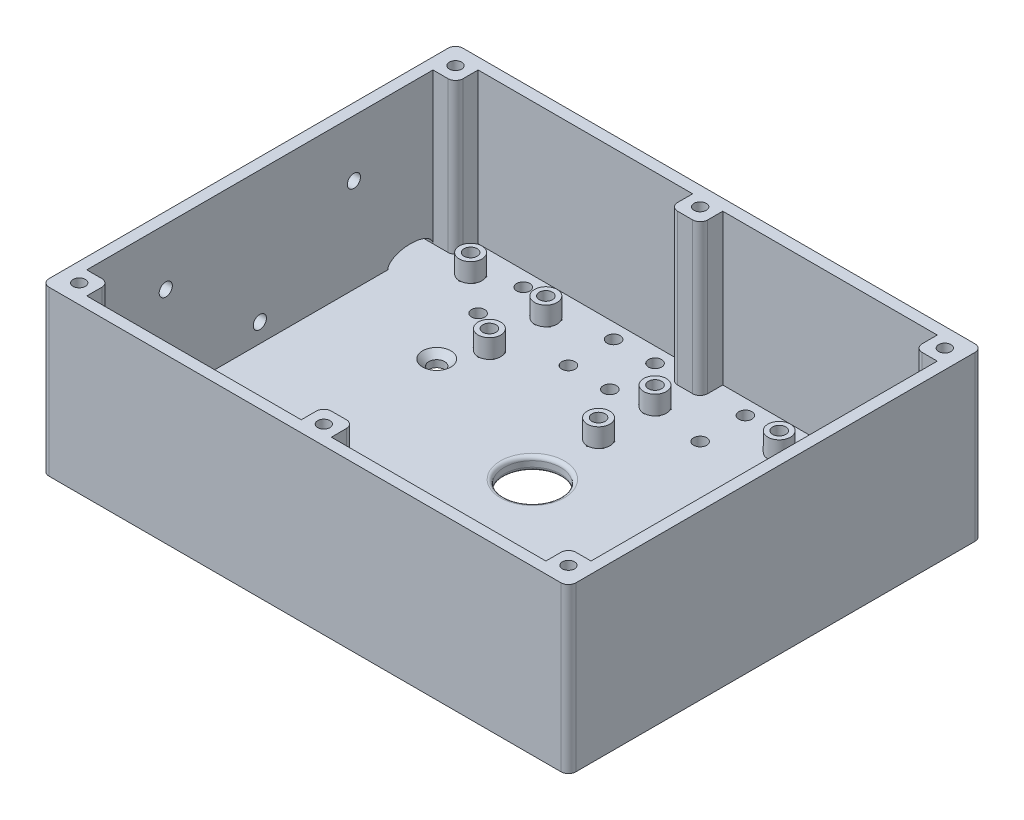
from build123d import *

# Parameters (mm, degrees)
SKETCH1_W                             = 140
SKETCH1_H                             = 110
BOTTOM_DEPTH                          = 3.5
SKETCH3_W                             = 140
SKETCH3_H                             = 110
WALL_DEPTH                            = 40
SKETCH4_R                             = 1.625
TOP_PLATE_SCREW_HOLES_DEPTH           = 30
TOP_PLATE_SCREW_HOLES_DRAFT           = -1
TOP_PLATE_SCREW_HOLES_PROFILE_2_DEPTH = 30
TOP_PLATE_SCREW_HOLES_PROFILE_2_DRAFT = -1
TOP_PLATE_SCREW_HOLES_PROFILE_3_DEPTH = 30
TOP_PLATE_SCREW_HOLES_PROFILE_3_DRAFT = -1
TOP_PLATE_SCREW_HOLES_PROFILE_4_DEPTH = 30
TOP_PLATE_SCREW_HOLES_PROFILE_4_DRAFT = -1
TOP_PLATE_SCREW_HOLES_PROFILE_5_DEPTH = 30
TOP_PLATE_SCREW_HOLES_PROFILE_5_DRAFT = -1
TOP_PLATE_SCREW_HOLES_PROFILE_6_DEPTH = 30
TOP_PLATE_SCREW_HOLES_PROFILE_6_DRAFT = -1
FILLET14_R                            = 2
FILLET13_R                            = 2
FILLET12_R                            = 2
FILLET11_R                            = 2
FILLET1_R                             = 2
FILLET2_R                             = 2
FILLET3_R                             = 2
FILLET4_R                             = 2
FILLET5_R                             = 2
FILLET6_R                             = 2
FILLET7_R                             = 2
FILLET8_R                             = 2
M4_MOUNT_R                            = 2.1
M4_MOUNT_CUT_DEPTH                    = 98.59610648
SKETCH7_R                             = 7.5
USB_CABEL_CUT_DEPTH                   = 100.082036717
FILLET9_R                             = 1
FILLET10_R                            = 1
SKETCH8_R                             = 1.75
UV_LAMP_M3_CUT_DEPTH                  = 10
M3_CONNECTION_R                       = 1.75
M3_CONNECTION_CUT_DEPTH               = 10
CABLE_PASS_CUT_DEPTH                  = 10
SKETCH9_R                             = 3
CURCUIT_BOARD_MOUNT_POSTS_EXT_DEPTH   = 5
SKETCH10_R                            = 1.75
M3_SCREW_CURCUIT_MOUNT_CUT_DEPTH      = 96.655632458
M3_HEAD_CIRCUIT_MOUNT_CUT_DEPTH       = 3.5


with BuildPart() as part:
    # Sketch1 → Bottom (new body)
    with BuildSketch(Plane(origin=(0, 0, 0), x_dir=(1, 0, 0), z_dir=(0, 1, 0))):
        Rectangle(SKETCH1_W, SKETCH1_H)
    extrude(amount=BOTTOM_DEPTH)

    # Sketch3 → Wall (add)
    with BuildSketch(Plane(origin=(0, 3.5, 0), x_dir=(1, 0, 0), z_dir=(0, 1, 0))):
        Rectangle(SKETCH3_W, SKETCH3_H)
        Polygon((-61, 52), (-4, 52), (-4, 46), (4, 46), (4, 52), (61, 52), (61, 46), (67, 46), (67, -46), (61, -46), (61, -52), (4, -52), (4, -46), (-4, -46), (-4, -52), (-61, -52), (-61, -46), (-67, -46), (-67, 46), (-61, 46), align=None, mode=Mode.SUBTRACT)
    extrude(amount=WALL_DEPTH)


with BuildPart() as top_plate_screw_holes_tool:
    # Sketch4 → Top Plate Screw Holes (with draft: the straight prism first)
    with BuildSketch(Plane(origin=(0, 43.5, 0), x_dir=(1, 0, 0), z_dir=(0, 1, 0))):
        with Locations((-65, 50)):
            Circle(SKETCH4_R)
    extrude(amount=-TOP_PLATE_SCREW_HOLES_DEPTH)
    # Top Plate Screw Holes: the draft: its side faces are tilted about the plane it starts from
    top_plate_screw_holes_sides = [top_plate_screw_holes_tool.faces().sort_by_distance(p)[0] for p in [
        (-66.625, 28.5, -50),
    ]]
    draft(top_plate_screw_holes_sides, Plane(origin=(0, 43.5, 0), x_dir=(1, 0, 0), z_dir=(0, 1, 0)), TOP_PLATE_SCREW_HOLES_DRAFT)


with BuildPart() as part_1:
    add(part.part)

    # Top Plate Screw Holes: cut by top_plate_screw_holes_tool
    add(top_plate_screw_holes_tool.part, mode=Mode.SUBTRACT)


with BuildPart() as top_plate_screw_holes_profile_2_tool:
    # Sketch4 → Top Plate Screw Holes profile 2 (with draft: the straight prism first)
    with BuildSketch(Plane(origin=(0, 43.5, 0), x_dir=(1, 0, 0), z_dir=(0, 1, 0))):
        with Locations((65, 50)):
            Circle(SKETCH4_R)
    extrude(amount=-TOP_PLATE_SCREW_HOLES_PROFILE_2_DEPTH)
    # Top Plate Screw Holes profile 2: the draft: its side faces are tilted about the plane it starts from
    top_plate_screw_holes_profile_2_sides = [top_plate_screw_holes_profile_2_tool.faces().sort_by_distance(p)[0] for p in [
        (63.375, 28.5, -50),
    ]]
    draft(top_plate_screw_holes_profile_2_sides, Plane(origin=(0, 43.5, 0), x_dir=(1, 0, 0), z_dir=(0, 1, 0)), TOP_PLATE_SCREW_HOLES_PROFILE_2_DRAFT)


with BuildPart() as part_2:
    add(part_1.part)

    # Top Plate Screw Holes profile 2: cut by top_plate_screw_holes_profile_2_tool
    add(top_plate_screw_holes_profile_2_tool.part, mode=Mode.SUBTRACT)


with BuildPart() as top_plate_screw_holes_profile_3_tool:
    # Sketch4 → Top Plate Screw Holes profile 3 (with draft: the straight prism first)
    with BuildSketch(Plane(origin=(0, 43.5, 0), x_dir=(1, 0, 0), z_dir=(0, 1, 0))):
        with Locations((65, -50)):
            Circle(SKETCH4_R)
    extrude(amount=-TOP_PLATE_SCREW_HOLES_PROFILE_3_DEPTH)
    # Top Plate Screw Holes profile 3: the draft: its side faces are tilted about the plane it starts from
    top_plate_screw_holes_profile_3_sides = [top_plate_screw_holes_profile_3_tool.faces().sort_by_distance(p)[0] for p in [
        (63.375, 28.5, 50),
    ]]
    draft(top_plate_screw_holes_profile_3_sides, Plane(origin=(0, 43.5, 0), x_dir=(1, 0, 0), z_dir=(0, 1, 0)), TOP_PLATE_SCREW_HOLES_PROFILE_3_DRAFT)


with BuildPart() as part_3:
    add(part_2.part)

    # Top Plate Screw Holes profile 3: cut by top_plate_screw_holes_profile_3_tool
    add(top_plate_screw_holes_profile_3_tool.part, mode=Mode.SUBTRACT)


with BuildPart() as top_plate_screw_holes_profile_4_tool:
    # Sketch4 → Top Plate Screw Holes profile 4 (with draft: the straight prism first)
    with BuildSketch(Plane(origin=(0, 43.5, 0), x_dir=(1, 0, 0), z_dir=(0, 1, 0))):
        with Locations((-65, -50)):
            Circle(SKETCH4_R)
    extrude(amount=-TOP_PLATE_SCREW_HOLES_PROFILE_4_DEPTH)
    # Top Plate Screw Holes profile 4: the draft: its side faces are tilted about the plane it starts from
    top_plate_screw_holes_profile_4_sides = [top_plate_screw_holes_profile_4_tool.faces().sort_by_distance(p)[0] for p in [
        (-66.625, 28.5, 50),
    ]]
    draft(top_plate_screw_holes_profile_4_sides, Plane(origin=(0, 43.5, 0), x_dir=(1, 0, 0), z_dir=(0, 1, 0)), TOP_PLATE_SCREW_HOLES_PROFILE_4_DRAFT)


with BuildPart() as part_4:
    add(part_3.part)

    # Top Plate Screw Holes profile 4: cut by top_plate_screw_holes_profile_4_tool
    add(top_plate_screw_holes_profile_4_tool.part, mode=Mode.SUBTRACT)


with BuildPart() as top_plate_screw_holes_profile_5_tool:
    # Sketch4 → Top Plate Screw Holes profile 5 (with draft: the straight prism first)
    with BuildSketch(Plane(origin=(0, 43.5, 0), x_dir=(1, 0, 0), z_dir=(0, 1, 0))):
        with Locations((0, 50)):
            Circle(SKETCH4_R)
    extrude(amount=-TOP_PLATE_SCREW_HOLES_PROFILE_5_DEPTH)
    # Top Plate Screw Holes profile 5: the draft: its side faces are tilted about the plane it starts from
    top_plate_screw_holes_profile_5_sides = [top_plate_screw_holes_profile_5_tool.faces().sort_by_distance(p)[0] for p in [
        (-1.625, 28.5, -50),
    ]]
    draft(top_plate_screw_holes_profile_5_sides, Plane(origin=(0, 43.5, 0), x_dir=(1, 0, 0), z_dir=(0, 1, 0)), TOP_PLATE_SCREW_HOLES_PROFILE_5_DRAFT)


with BuildPart() as part_5:
    add(part_4.part)

    # Top Plate Screw Holes profile 5: cut by top_plate_screw_holes_profile_5_tool
    add(top_plate_screw_holes_profile_5_tool.part, mode=Mode.SUBTRACT)


with BuildPart() as top_plate_screw_holes_profile_6_tool:
    # Sketch4 → Top Plate Screw Holes profile 6 (with draft: the straight prism first)
    with BuildSketch(Plane(origin=(0, 43.5, 0), x_dir=(1, 0, 0), z_dir=(0, 1, 0))):
        with Locations((0, -50)):
            Circle(SKETCH4_R)
    extrude(amount=-TOP_PLATE_SCREW_HOLES_PROFILE_6_DEPTH)
    # Top Plate Screw Holes profile 6: the draft: its side faces are tilted about the plane it starts from
    top_plate_screw_holes_profile_6_sides = [top_plate_screw_holes_profile_6_tool.faces().sort_by_distance(p)[0] for p in [
        (-1.625, 28.5, 50),
    ]]
    draft(top_plate_screw_holes_profile_6_sides, Plane(origin=(0, 43.5, 0), x_dir=(1, 0, 0), z_dir=(0, 1, 0)), TOP_PLATE_SCREW_HOLES_PROFILE_6_DRAFT)


with BuildPart() as part_6:
    add(part_5.part)

    # Top Plate Screw Holes profile 6: cut by top_plate_screw_holes_profile_6_tool
    add(top_plate_screw_holes_profile_6_tool.part, mode=Mode.SUBTRACT)

    # Fillet14
    fillet14_edges = [part_6.edges().sort_by_distance(p)[0] for p in [
        (-4, 23.5, 46),
    ]]
    fillet(fillet14_edges, radius=FILLET14_R)

    # Fillet13
    fillet13_edges = [part_6.edges().sort_by_distance(p)[0] for p in [
        (4, 23.5, 46),
    ]]
    fillet(fillet13_edges, radius=FILLET13_R)

    # Fillet12
    fillet12_edges = [part_6.edges().sort_by_distance(p)[0] for p in [
        (-4, 23.5, -46),
    ]]
    fillet(fillet12_edges, radius=FILLET12_R)

    # Fillet11
    fillet11_edges = [part_6.edges().sort_by_distance(p)[0] for p in [
        (4, 23.5, -46),
    ]]
    fillet(fillet11_edges, radius=FILLET11_R)

    # Fillet1
    fillet1_edges = [part_6.edges().sort_by_distance(p)[0] for p in [
        (-61, 23.5, 46),
    ]]
    fillet(fillet1_edges, radius=FILLET1_R)

    # Fillet2
    fillet2_edges = [part_6.edges().sort_by_distance(p)[0] for p in [
        (61, 23.5, 46),
    ]]
    fillet(fillet2_edges, radius=FILLET2_R)

    # Fillet3
    fillet3_edges = [part_6.edges().sort_by_distance(p)[0] for p in [
        (61, 23.5, -46),
    ]]
    fillet(fillet3_edges, radius=FILLET3_R)

    # Fillet4
    fillet4_edges = [part_6.edges().sort_by_distance(p)[0] for p in [
        (-61, 23.5, -46),
    ]]
    fillet(fillet4_edges, radius=FILLET4_R)

    # Fillet5
    fillet5_edges = [part_6.edges().sort_by_distance(p)[0] for p in [
        (-70, 21.75, -55),
    ]]
    fillet(fillet5_edges, radius=FILLET5_R)

    # Fillet6
    fillet6_edges = [part_6.edges().sort_by_distance(p)[0] for p in [
        (70, 21.75, -55),
    ]]
    fillet(fillet6_edges, radius=FILLET6_R)

    # Fillet7
    fillet7_edges = [part_6.edges().sort_by_distance(p)[0] for p in [
        (70, 21.75, 55),
    ]]
    fillet(fillet7_edges, radius=FILLET7_R)

    # Fillet8
    fillet8_edges = [part_6.edges().sort_by_distance(p)[0] for p in [
        (-70, 21.75, 55),
    ]]
    fillet(fillet8_edges, radius=FILLET8_R)

    # M4 Mount → M4 Mount Cut (cut, through all)
    with BuildSketch(Plane.XZ.offset(-3.5)):
        with Locations(Location((40, -20, 0), (0, 0, 270))):
            Circle(M4_MOUNT_R)
        with Locations(Location((40, 20, 0), (0, 0, 270))):
            Circle(M4_MOUNT_R)
        with Locations(Location((-40, 20, 0), (0, 0, 90))):
            Circle(M4_MOUNT_R)
        with Locations(Location((-40, -20, 0), (0, 0, 90))):
            Circle(M4_MOUNT_R)
    extrude(amount=M4_MOUNT_CUT_DEPTH, mode=Mode.SUBTRACT)

    # Cut-Extrude3 cone 1 section (through the dimple's axis) → Cut-Extrude3 (revolve, cut)
    with BuildSketch(Plane(origin=(40, 3.5, 20), x_dir=(0, 0, 1), z_dir=(1, 0, 0))):
        Polygon((0, 0), (3.75, 0), (0, 3.75), align=None)
    revolve(axis=Axis((40, 3.5, 20), (0, -1, 0)), mode=Mode.SUBTRACT)

    # Cut-Extrude3 cone 2 section (through the dimple's axis) → Cut-Extrude3 cone 2 (revolve, cut)
    with BuildSketch(Plane(origin=(40, 3.5, -20), x_dir=(0, 0, 1), z_dir=(1, 0, 0))):
        Polygon((0, 0), (3.75, 0), (0, 3.75), align=None)
    revolve(axis=Axis((40, 3.5, -20), (0, -1, 0)), mode=Mode.SUBTRACT)

    # Cut-Extrude3 cone 3 section (through the dimple's axis) → Cut-Extrude3 cone 3 (revolve, cut)
    with BuildSketch(Plane(origin=(-40, 3.5, -20), x_dir=(0, 0, 1), z_dir=(1, 0, 0))):
        Polygon((0, 0), (3.75, 0), (0, 3.75), align=None)
    revolve(axis=Axis((-40, 3.5, -20), (0, -1, 0)), mode=Mode.SUBTRACT)

    # Cut-Extrude3 cone 4 section (through the dimple's axis) → Cut-Extrude3 cone 4 (revolve, cut)
    with BuildSketch(Plane(origin=(-40, 3.5, 20), x_dir=(0, 0, 1), z_dir=(1, 0, 0))):
        Polygon((0, 0), (3.75, 0), (0, 3.75), align=None)
    revolve(axis=Axis((-40, 3.5, 20), (0, -1, 0)), mode=Mode.SUBTRACT)

    # Sketch7 → USB Cabel Cut (cut, through all)
    with BuildSketch(Plane.XZ):
        with Locations(Location((0.418373374, -5, 0), (0, 0, 270))):
            Circle(SKETCH7_R)
    extrude(amount=-USB_CABEL_CUT_DEPTH, mode=Mode.SUBTRACT)

    # Fillet9
    fillet9_edges = [part_6.edges().sort_by_distance(p)[0] for p in [
        (0.418373374, 0, 2.5),
    ]]
    fillet(fillet9_edges, radius=FILLET9_R)

    # Fillet10
    fillet10_edges = [part_6.edges().sort_by_distance(p)[0] for p in [
        (0.418373374, 3.5, 2.5),
    ]]
    fillet(fillet10_edges, radius=FILLET10_R)

    # Sketch8 → UV LAMP M3 CUT (cut)
    with BuildSketch(Plane(origin=(0, 3.5, 0), x_dir=(1, 0, 0), z_dir=(0, 1, 0))):
        with Locations(Location((-10, 48, 0), (0, 0, 270))):
            Circle(SKETCH8_R)
        with Locations(Location((-10, 36, 0), (0, 0, 270))):
            Circle(SKETCH8_R)
        with Locations(Location((14, 48, 0), (0, 0, 270))):
            Circle(SKETCH8_R)
        with Locations(Location((14, 36, 0), (0, 0, 270))):
            Circle(SKETCH8_R)
        with Locations(Location((-45, 48, 0), (0, 0, 270))):
            Circle(SKETCH8_R)
        with Locations(Location((-45, 36, 0), (0, 0, 270))):
            Circle(SKETCH8_R)
        with Locations(Location((-21, 48, 0), (0, 0, 270))):
            Circle(SKETCH8_R)
        with Locations(Location((-21, 36, 0), (0, 0, 270))):
            Circle(SKETCH8_R)
    extrude(amount=-UV_LAMP_M3_CUT_DEPTH, mode=Mode.SUBTRACT)

    # M3 Connection → M3 Connection CUT (cut)
    with BuildSketch(Plane(origin=(-67, 0, 0), x_dir=(0, 0, -1), z_dir=(1, 0, 0))):
        with Locations((25, 28.5)):
            Circle(M3_CONNECTION_R)
        with Locations((0, 8.5)):
            Circle(M3_CONNECTION_R)
        with Locations((-25, 28.5)):
            Circle(M3_CONNECTION_R)
    extrude(amount=-M3_CONNECTION_CUT_DEPTH, mode=Mode.SUBTRACT)

    # Cable Pass → Cable Pass CUT (cut)
    with BuildSketch(Plane(origin=(-67, 0, 0), x_dir=(0, 0, -1), z_dir=(1, 0, 0))):
        with BuildLine():
            Line((46, 3.5), (34, 3.5))
            add(Edge.make_bspline(
                [(46, 3.5), (46, 6.5), (40, 6.5), (34, 6.5), (34, 3.5)],
                knots=[3.141592654, 3.141592654, 3.141592654, 4.71238898, 4.71238898, 6.283185307, 6.283185307, 6.283185307], degree=2, weights=[1, 0.707106781, 1, 0.707106781, 1]))
        make_face()
    extrude(amount=-CABLE_PASS_CUT_DEPTH, mode=Mode.SUBTRACT)

    # Sketch9 → Curcuit Board Mount Posts EXT (add)
    with BuildSketch(Plane(origin=(0, 3.5, 0), x_dir=(1, 0, 0), z_dir=(0, 1, 0))):
        with Locations(Location((47, 44, 0), (0, 0, 270))):
            Circle(SKETCH9_R)
        with Locations(Location((27, 44, 0), (0, 0, 270))):
            Circle(SKETCH9_R)
        with Locations(Location((47, 29, 0), (0, 0, 270))):
            Circle(SKETCH9_R)
        with Locations(Location((-35, 44, 0), (0, 0, 270))):
            Circle(SKETCH9_R)
        with Locations(Location((-35, 29, 0), (0, 0, 270))):
            Circle(SKETCH9_R)
        with Locations(Location((-55, 44, 0), (0, 0, 270))):
            Circle(SKETCH9_R)
        with Locations(Location((0, 38, 0), (0, 0, 270))):
            Circle(SKETCH9_R)
        with Locations(Location((0, 23, 0), (0, 0, 270))):
            Circle(SKETCH9_R)
    extrude(amount=CURCUIT_BOARD_MOUNT_POSTS_EXT_DEPTH)

    # Sketch10 → M3 Screw Curcuit Mount CUT (cut, through all)
    with BuildSketch(Plane(origin=(0, 8.5, 0), x_dir=(1, 0, 0), z_dir=(0, 1, 0))):
        with Locations(Location((-55, 44, 0), (0, 0, 270))):
            Circle(SKETCH10_R)
        with Locations(Location((-35, 44, 0), (0, 0, 270))):
            Circle(SKETCH10_R)
        with Locations(Location((-35, 29, 0), (0, 0, 270))):
            Circle(SKETCH10_R)
        with Locations(Location((27, 44, 0), (0, 0, 270))):
            Circle(SKETCH10_R)
        with Locations(Location((47, 44, 0), (0, 0, 270))):
            Circle(SKETCH10_R)
        with Locations(Location((47, 29, 0), (0, 0, 270))):
            Circle(SKETCH10_R)
        with Locations(Location((0, 38, 0), (0, 0, 270))):
            Circle(SKETCH10_R)
        with Locations(Location((0, 23, 0), (0, 0, 270))):
            Circle(SKETCH10_R)
    extrude(amount=-M3_SCREW_CURCUIT_MOUNT_CUT_DEPTH, mode=Mode.SUBTRACT)

    # Sketch11 → M3 Head Circuit Mount CUT (cut)
    with BuildSketch(Plane.XZ):
        Polygon((-35, -47.175426481), (-32.25, -45.58771324), (-32.25, -42.41228676), (-35, -40.824573519), (-37.75, -42.41228676), (-37.75, -45.58771324), align=None)
        Polygon((-55, -47.175426481), (-52.25, -45.58771324), (-52.25, -42.41228676), (-55, -40.824573519), (-57.75, -42.41228676), (-57.75, -45.58771324), align=None)
        Polygon((-35, -32.175426481), (-32.25, -30.58771324), (-32.25, -27.41228676), (-35, -25.824573519), (-37.75, -27.41228676), (-37.75, -30.58771324), align=None)
        Polygon((27, -47.175426481), (29.75, -45.58771324), (29.75, -42.41228676), (27, -40.824573519), (24.25, -42.41228676), (24.25, -45.58771324), align=None)
        Polygon((47, -47.175426481), (49.75, -45.58771324), (49.75, -42.41228676), (47, -40.824573519), (44.25, -42.41228676), (44.25, -45.58771324), align=None)
        Polygon((47, -32.175426481), (49.75, -30.58771324), (49.75, -27.41228676), (47, -25.824573519), (44.25, -27.41228676), (44.25, -30.58771324), align=None)
        Polygon((0, -41.175426481), (2.75, -39.58771324), (2.75, -36.41228676), (0, -34.824573519), (-2.75, -36.41228676), (-2.75, -39.58771324), align=None)
        Polygon((0, -26.175426481), (2.75, -24.58771324), (2.75, -21.41228676), (0, -19.824573519), (-2.75, -21.41228676), (-2.75, -24.58771324), align=None)
    extrude(amount=-M3_HEAD_CIRCUIT_MOUNT_CUT_DEPTH, mode=Mode.SUBTRACT)


solid = part_6.part
